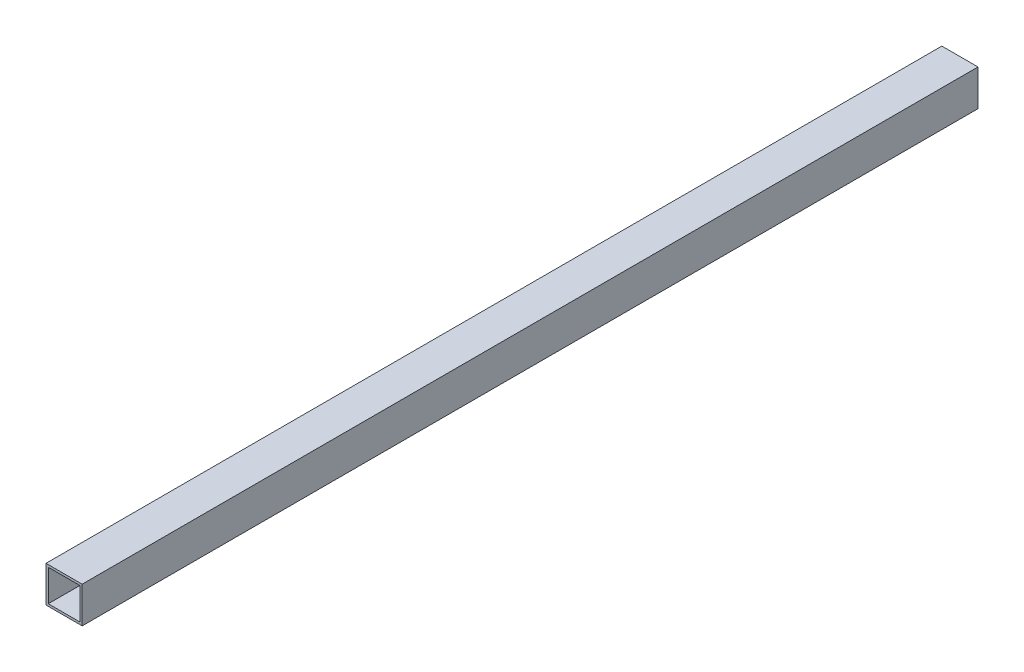
from build123d import *

# Parameters (mm, degrees)
SKETCH1_W           = 25.4
SKETCH1_H           = 25.4
SKETCH1_W_2         = 22.225
SKETCH1_H_2         = 22.225
BOSS_EXTRUDE1_DEPTH = 314.6396933


with BuildPart() as part:
    # Sketch1 → Boss-Extrude1 (new, symmetric)
    with BuildSketch(Plane.XY):
        Rectangle(SKETCH1_W, SKETCH1_H)
        Rectangle(SKETCH1_W_2, SKETCH1_H_2, mode=Mode.SUBTRACT)
    extrude(amount=BOSS_EXTRUDE1_DEPTH, both=True)


solid = part.part
